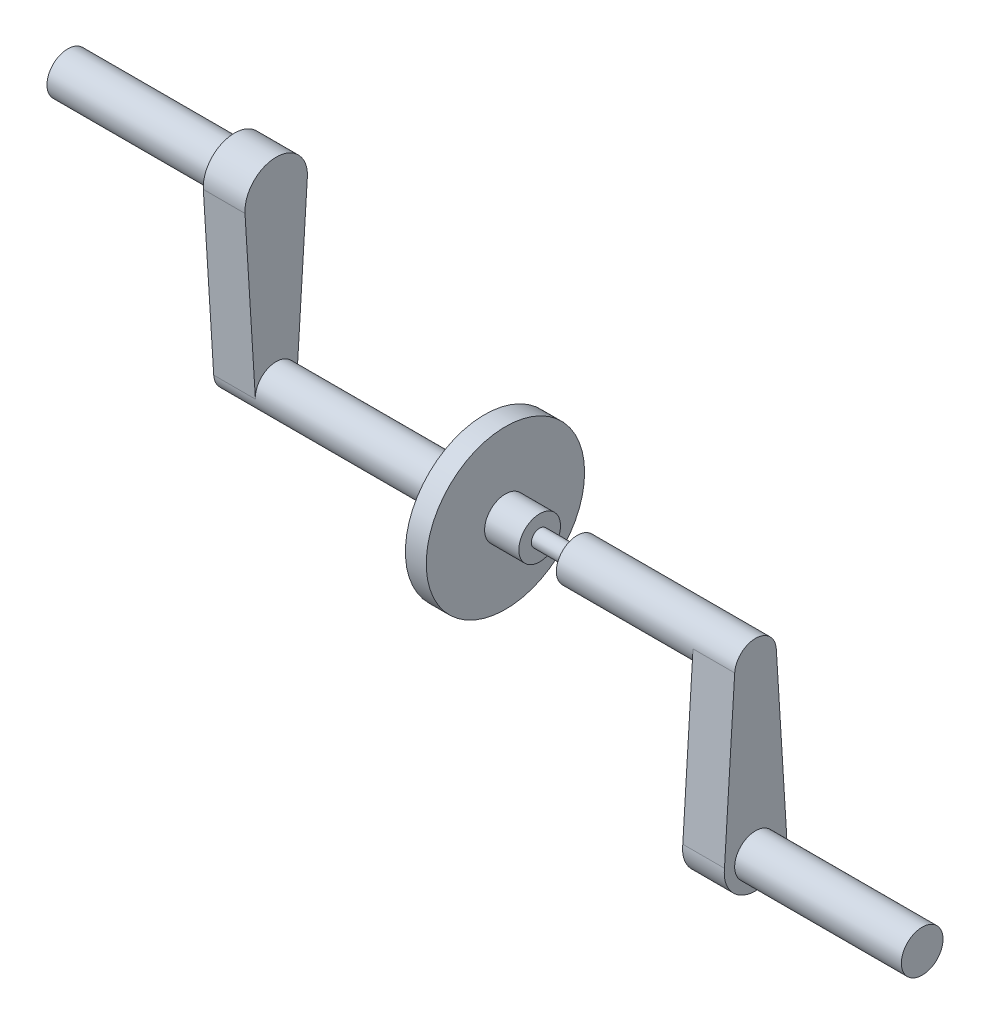
from build123d import *

# Parameters (mm, degrees)
CROQUIS1_R              = 38
SALIENTE_EXTRUIR2_DEPTH = 5
CROQUIS2_R              = 10
SALIENTE_EXTRUIR3_DEPTH = 100
SALIENTE_EXTRUIR4_DEPTH = 20
CROQUIS4_R              = 10
SALIENTE_EXTRUIR5_DEPTH = 80
SALIENTE_EXTRUIR6_DEPTH = 20
CROQUIS6_R              = 10
SALIENTE_EXTRUIR7_DEPTH = 80
CROQUIS7_R              = 10
CROQUIS7_R_2            = 4
CORTAR_EXTRUIR1_DEPTH   = 18


with BuildPart() as part:
    # Croquis1 → Saliente-Extruir2 (new, symmetric)
    with BuildSketch(Plane(origin=(0, 0, 0), x_dir=(0, 0, -1), z_dir=(1, 0, 0))):
        Circle(CROQUIS1_R)
    extrude(amount=SALIENTE_EXTRUIR2_DEPTH, both=True)

    # Croquis2 → Saliente-Extruir3 (add)
    with BuildSketch(Plane(origin=(5, 0, 0), x_dir=(0, 0, -1), z_dir=(1, 0, 0))):
        Circle(CROQUIS2_R)
    saliente_extruir3 = extrude(amount=SALIENTE_EXTRUIR3_DEPTH)

    # Croquis3 → Saliente-Extruir4 (add)
    with BuildSketch(Plane(origin=(105, 0, 0), x_dir=(0, 0, -1), z_dir=(1, 0, 0))):
        with BuildLine():
            Line((-9.980675877, 0.621376727), (-14.884167289, -78.139472087))
            ThreePointArc((-14.884167289, -78.139472087), (0, -95), (14.884167289, -78.139472087))
            Line((14.884167289, -78.139472087), (9.980675877, 0.621376727))
            ThreePointArc((9.980675877, 0.621376727), (0, 10), (-9.980675877, 0.621376727))
        make_face()
    extrude(amount=SALIENTE_EXTRUIR4_DEPTH)

    # Croquis4 → Saliente-Extruir5 (add)
    with BuildSketch(Plane(origin=(125, 0, 0), x_dir=(0, 0, -1), z_dir=(1, 0, 0))):
        with Locations((0, -80)):
            Circle(CROQUIS4_R)
    extrude(amount=SALIENTE_EXTRUIR5_DEPTH)

    # Simetría1: Saliente-Extruir3 across plane
    add(saliente_extruir3.mirror(Plane(origin=(0, 0, 0), x_dir=(0, 0, 1), z_dir=(1, 0, 0))))

    # Croquis5 → Saliente-Extruir6 (add)
    with BuildSketch(Plane.ZY.offset(105)):
        with BuildLine():
            Line((-14.884167289, 78.139472087), (-9.980675877, -0.621376727))
            ThreePointArc((-9.980675877, -0.621376727), (-0.001815165, -9.999999835), (9.980449639, -0.625))
            Line((9.980449639, -0.625), (14.970674459, 79.0625))
            ThreePointArc((14.970674459, 79.0625), (-0.463536411, 94.992836089), (-14.884167289, 78.139472087))
        make_face()
    extrude(amount=SALIENTE_EXTRUIR6_DEPTH)

    # Croquis6 → Saliente-Extruir7 (add)
    with BuildSketch(Plane.ZY.offset(125)):
        with Locations((0, 80)):
            Circle(CROQUIS6_R)
    extrude(amount=SALIENTE_EXTRUIR7_DEPTH)

    # Croquis7 → Cortar-Extruir1 (cut)
    with BuildSketch(Plane(origin=(39.44, 0, 0), x_dir=(0, 0, -1), z_dir=(1, 0, 0))):
        Circle(CROQUIS7_R)
        Circle(CROQUIS7_R_2, mode=Mode.SUBTRACT)
    extrude(amount=-CORTAR_EXTRUIR1_DEPTH, mode=Mode.SUBTRACT)


solid = part.part
